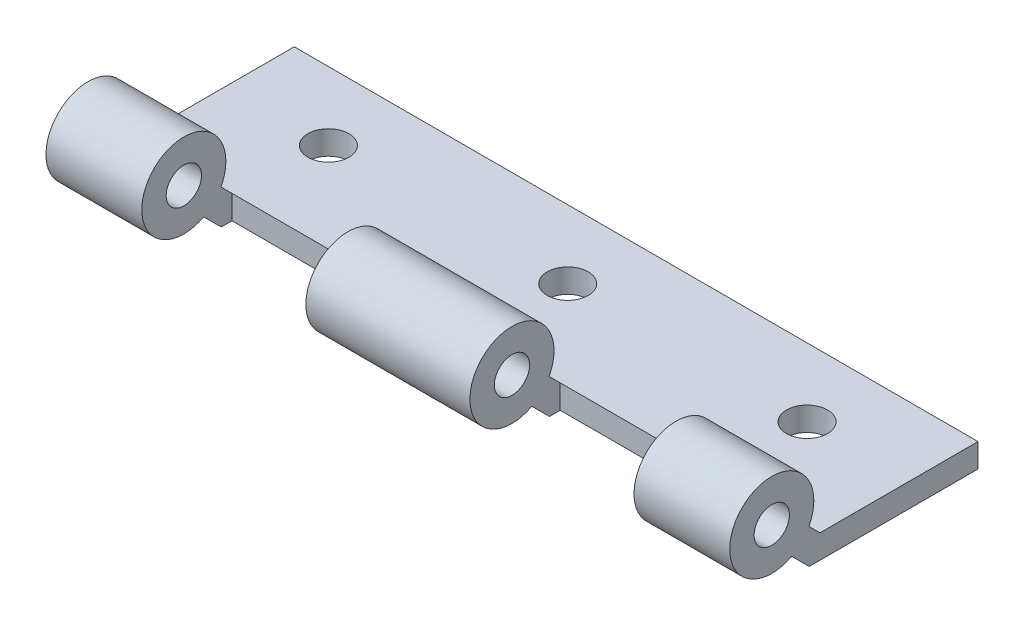
from build123d import *

# Parameters (mm, degrees)
SKETCH3_R          = 2.5796875
RIGHT_LEAF_DEPTH   = 50.0065
SKETCH11_R         = 3
CUT_EXTRUDE1_DEPTH = 10
CUT_EXTRUDE2_DEPTH = 24
CUT_EXTRUDE5_DEPTH = 24


with BuildPart() as part:
    # Sketch3 → Right Leaf (new, symmetric)
    with BuildSketch(Plane(origin=(0, 0, 0), x_dir=(0, 0, -1), z_dir=(1, 0, 0))):
        with BuildLine():
            Line((5.474302966, -8), (30.1625, -8))
            Line((30.1625, -8), (30.1625, -4.5202))
            Line((30.1625, -4.5202), (7.045897034, -4.5202))
            Line((7.045897034, -4.5202), (5.425308633, -2.899611599))
            ThreePointArc((5.425308633, -2.899611599), (-4.349811559, 4.349811559), (2.899611599, -5.425308633))
            Line((2.899611599, -5.425308633), (5.474302966, -8))
        make_face()
        Circle(SKETCH3_R, mode=Mode.SUBTRACT)
    extrude(amount=RIGHT_LEAF_DEPTH, both=True)

    # Sketch11 → Cut-Extrude1 (cut)
    with BuildSketch(Plane(origin=(0, -4.5202, 0), x_dir=(1, 0, 0), z_dir=(0, 1, 0))):
        with Locations(Location((-35.0065, 20.1625, 0), (0, 0, 270))):
            Circle(SKETCH11_R)
        with Locations(Location((-0.0065, 20.1625, 0), (0, 0, 270))):
            Circle(SKETCH11_R)
        with Locations(Location((34.9935, 20.1625, 0), (0, 0, 270))):
            Circle(SKETCH11_R)
    extrude(amount=-CUT_EXTRUDE1_DEPTH, mode=Mode.SUBTRACT)

    # Sketch12 → Cut-Extrude2 (cut)
    with BuildSketch(Plane(origin=(36.0065, 0, 0), x_dir=(0, 0, -1), z_dir=(1, 0, 0))):
        with BuildLine():
            Line((2.899611599, -5.425308633), (5.474302966, -8))
            Line((5.474302966, -8), (7.045897034, -8))
            Line((7.045897034, -8), (7.045897034, -4.5202))
            Line((7.045897034, -4.5202), (5.425308633, -2.899611599))
            ThreePointArc((5.425308633, -2.899611599), (-4.349811559, 4.349811559), (2.899611599, -5.425308633))
        make_face()
    extrude(amount=-CUT_EXTRUDE2_DEPTH, mode=Mode.SUBTRACT)

    # Sketch14 → Cut-Extrude5 (cut)
    with BuildSketch(Plane.ZY.offset(11.9935)):
        with BuildLine():
            Line((-5.425308633, -2.899611599), (-7.045897034, -4.5202))
            Line((-7.045897034, -4.5202), (-7.045897034, -8))
            Line((-7.045897034, -8), (-5.474302966, -8))
            Line((-5.474302966, -8), (-2.899611599, -5.425308633))
            ThreePointArc((-2.899611599, -5.425308633), (4.349811559, 4.349811559), (-5.425308633, -2.899611599))
        make_face()
    extrude(amount=CUT_EXTRUDE5_DEPTH, mode=Mode.SUBTRACT)


solid = part.part
